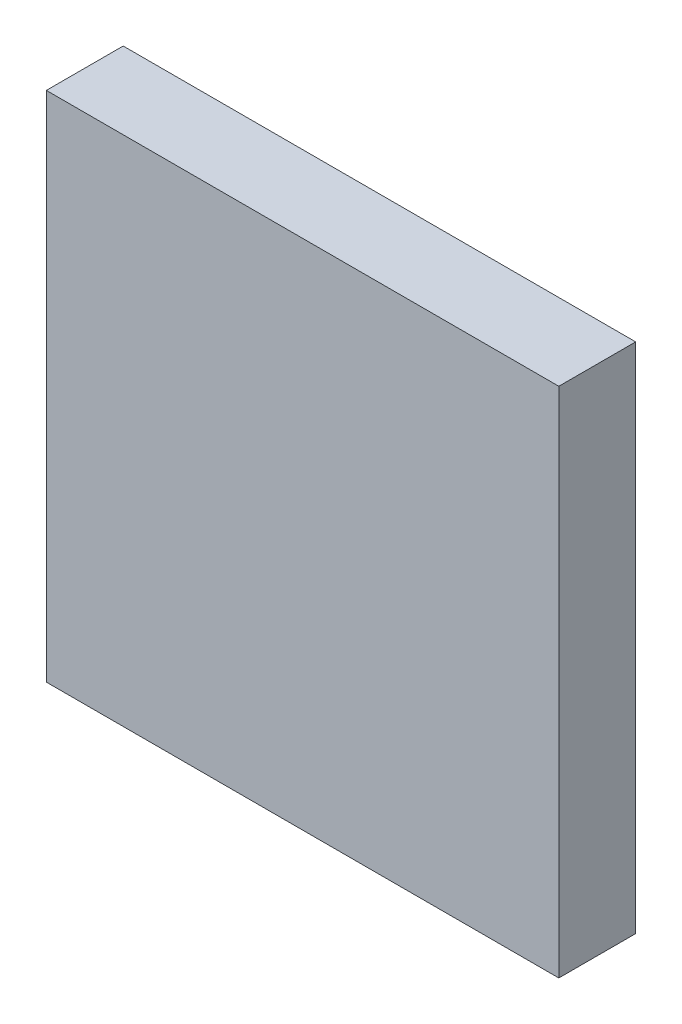
from build123d import *

# Parameters (mm, degrees)
CROQUIS1_W              = 100
CROQUIS1_H              = 100
SALIENTE_EXTRUIR1_DEPTH = 15


with BuildPart() as part:
    # Croquis1 → Saliente-Extruir1 (new body)
    with BuildSketch(Plane.XY):
        with Locations((50, 50)):
            Rectangle(CROQUIS1_W, CROQUIS1_H)
    extrude(amount=SALIENTE_EXTRUIR1_DEPTH)


solid = part.part
